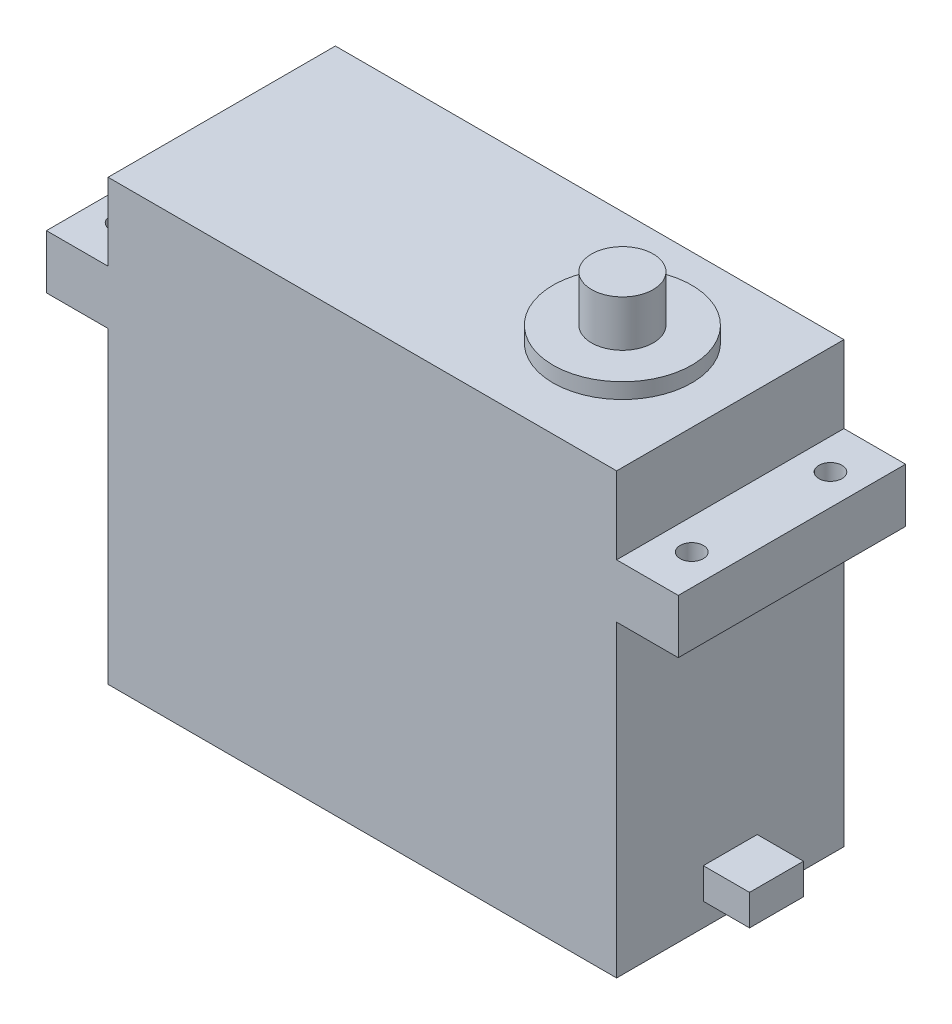
from build123d import *

# Parameters (mm, degrees)
ESQUISSE1_W        = 66
ESQUISSE1_H        = 29.5
BOSS_EXTRU_1_DEPTH = 57
ESQUISSE2_R        = 9
BOSS_EXTRU_2_DEPTH = 2
ESQUISSE3_R        = 4
BOSS_EXTRU_3_DEPTH = 6
BOSS_EXTRU_4_START = 40
ESQUISSE4_W        = 82
ESQUISSE4_H        = 29.5
ESQUISSE4_R        = 1.5
BOSS_EXTRU_4_DEPTH = 7
ESQUISSE5_W        = 7
ESQUISSE5_H        = 4
BOSS_EXTRU_5_DEPTH = 6


with BuildPart() as part:
    # Esquisse1 → Boss.-Extru.1 (new body)
    with BuildSketch(Plane(origin=(0, 0, 0), x_dir=(1, 0, 0), z_dir=(0, 1, 0))):
        with Locations((-19, 0)):
            Rectangle(ESQUISSE1_W, ESQUISSE1_H)
    extrude(amount=BOSS_EXTRU_1_DEPTH)

    # Esquisse2 → Boss.-Extru.2 (add)
    with BuildSketch(Plane(origin=(0, 57, 0), x_dir=(1, 0, 0), z_dir=(0, 1, 0))):
        with Locations(Location((0, 0, 0), (0, 0, 270))):
            Circle(ESQUISSE2_R)
    extrude(amount=BOSS_EXTRU_2_DEPTH)

    # Esquisse3 → Boss.-Extru.3 (add)
    with BuildSketch(Plane(origin=(0, 59, 0), x_dir=(1, 0, 0), z_dir=(0, 1, 0))):
        with Locations(Location((0, 0, 0), (0, 0, 270))):
            Circle(ESQUISSE3_R)
    extrude(amount=BOSS_EXTRU_3_DEPTH)

    # Esquisse4 → Boss.-Extru.4 (add)
    with BuildSketch(Plane(origin=(0, 0, 0), x_dir=(1, 0, 0), z_dir=(0, 1, 0)).offset(BOSS_EXTRU_4_START)):
        with Locations((-19, 0)):
            Rectangle(ESQUISSE4_W, ESQUISSE4_H)
        with Locations(Location((-56, 9, 0), (0, 0, 270))):
            Circle(ESQUISSE4_R, mode=Mode.SUBTRACT)
        with Locations(Location((-56, -9, 0), (0, 0, 90))):
            Circle(ESQUISSE4_R, mode=Mode.SUBTRACT)
        with Locations(Location((18, -9, 0), (0, 0, 270))):
            Circle(ESQUISSE4_R, mode=Mode.SUBTRACT)
        with Locations(Location((18, 9, 0), (0, 0, 90))):
            Circle(ESQUISSE4_R, mode=Mode.SUBTRACT)
    extrude(amount=BOSS_EXTRU_4_DEPTH)

    # Esquisse5 → Boss.-Extru.5 (add)
    with BuildSketch(Plane(origin=(14, 0, 0), x_dir=(0, 0, -1), z_dir=(1, 0, 0))):
        with Locations((0, 5)):
            Rectangle(ESQUISSE5_W, ESQUISSE5_H)
    extrude(amount=BOSS_EXTRU_5_DEPTH)


solid = part.part
